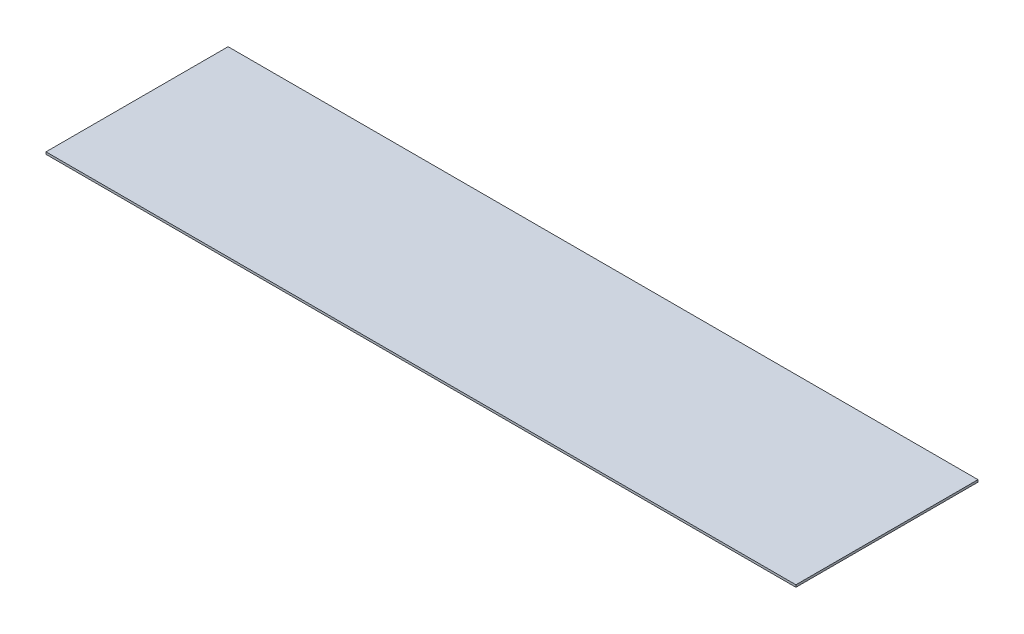
from build123d import *

# Parameters (mm, degrees)
SKETCH1_W           = 863.6
SKETCH1_H           = 209.7
BOSS_EXTRUDE1_DEPTH = 2.54


with BuildPart() as part:
    # Sketch1 → Boss-Extrude1 (new body)
    with BuildSketch(Plane(origin=(0, 0, 0), x_dir=(1, 0, 0), z_dir=(0, 1, 0))):
        with Locations((431.8, 104.85)):
            Rectangle(SKETCH1_W, SKETCH1_H)
    extrude(amount=BOSS_EXTRUDE1_DEPTH)


solid = part.part
